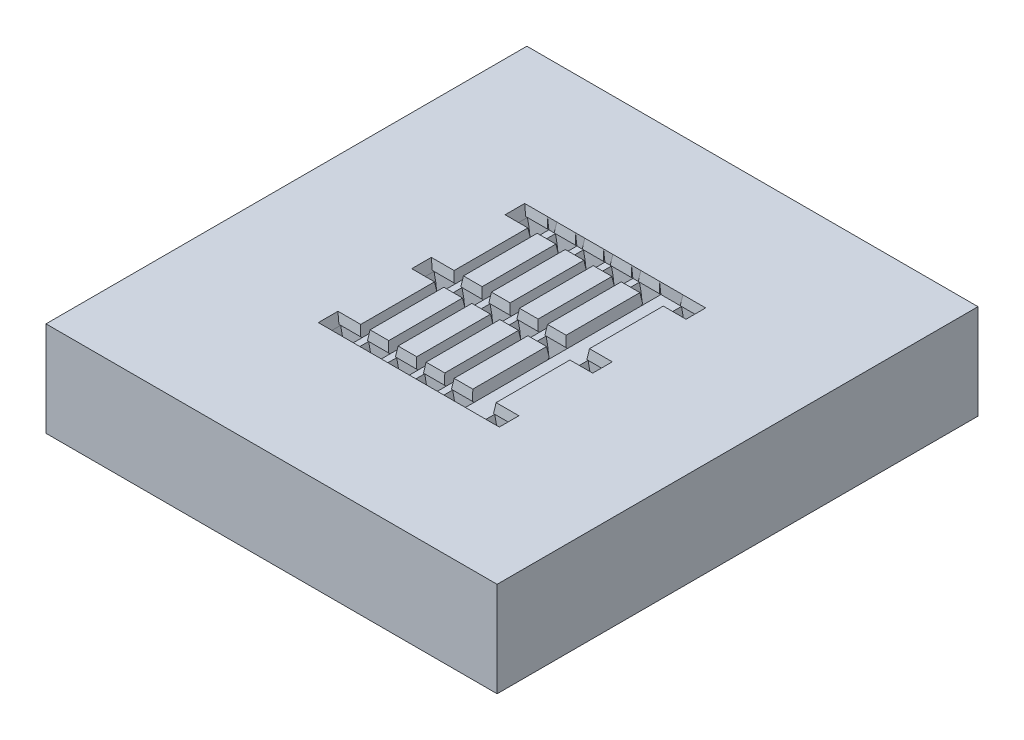
from build123d import *

# Parameters (mm, degrees)
BOSS_EXTRUDE2_START = -1.844035
SKETCH1_W           = 48.312388156
SKETCH1_H           = 51.5
BOSS_EXTRUDE2_DEPTH = 10.155965
CUT_EXTRUDE1_START  = -9.690354
CUT_EXTRUDE1_DEPTH  = 19.380708
CUT_EXTRUDE2_START  = 11.05
CUT_EXTRUDE2_DEPTH  = 22.1
BOSS_EXTRUDE3_START = -11.05
BOSS_EXTRUDE3_DEPTH = 22.1


with BuildPart() as part:
    # Sketch1 → Boss-Extrude2 (new body)
    with BuildSketch(Plane(origin=(0, 0, 0), x_dir=(1, 0, 0), z_dir=(0, 1, 0)).offset(BOSS_EXTRUDE2_START)):
        Rectangle(SKETCH1_W, SKETCH1_H)
    extrude(amount=-BOSS_EXTRUDE2_DEPTH)

    # Sketch7 → Cut-Extrude1 (cut)
    with BuildSketch(Plane(origin=(0, 0, 0), x_dir=(0, 0, -1), z_dir=(1, 0, 0)).offset(CUT_EXTRUDE1_START)):
        Polygon((10.9, -2.85), (11.05, -1.84403522), (8.95, -1.84403522), (9.1, -2.85), (8.95, -3), (8.95, -6.5), (11.05, -6.5), (11.05, -3), align=None)
        Polygon((-10.9, -2.85), (-11.05, -1.84403522), (-8.95, -1.84403522), (-9.1, -2.85), (-8.95, -3), (-8.95, -6.5), (-11.05, -6.5), (-11.05, -3), align=None)
        Polygon((-0.9, -2.85), (-1.05, -1.84403522), (1.05, -1.84403522), (0.9, -2.85), (1.05, -3), (1.05, -6.5), (-1.05, -6.5), (-1.05, -3), align=None)
    extrude(amount=CUT_EXTRUDE1_DEPTH, mode=Mode.SUBTRACT)

    # Sketch8 → Cut-Extrude2 (cut)
    with BuildSketch(Plane.XY.offset(CUT_EXTRUDE2_START)):
        Polygon((-7.25, -1.84403522), (-7.100480321, -3), (-6.399519679, -3), (-6.25, -1.84403522), align=None)
        Polygon((-4.25, -1.84403522), (-4.100480321, -3), (-3.399519679, -3), (-3.25, -1.84403522), align=None)
        Polygon((-1.25, -1.84403522), (-1.100480321, -3), (-0.399519679, -3), (-0.25, -1.84403522), align=None)
        Polygon((1.899519679, -3), (2.600480321, -3), (2.75, -1.84403522), (1.75, -1.84403522), align=None)
        Polygon((4.899519679, -3), (7.100480321, -3), (7.25, -1.84403522), (4.75, -1.84403522), align=None)
    extrude(amount=-CUT_EXTRUDE2_DEPTH, mode=Mode.SUBTRACT)

    # Sketch9 → Boss-Extrude3 (add)
    with BuildSketch(Plane.XY.offset(BOSS_EXTRUDE3_START)):
        with BuildLine():
            Line((-9.690353566, -1.84403522), (-9.690353566, -6.5))
            Line((-9.690353566, -6.5), (-9.115955217, -6.5))
            ThreePointArc((-9.115955217, -6.5), (-9.112473191, -4.73823092), (-9.399519679, -3))
            Line((-9.399519679, -3), (-9.690353566, -1.84403522))
        make_face()
        with BuildLine():
            Line((9.690353566, -1.84403522), (9.399519679, -3))
            ThreePointArc((9.399519679, -3), (9.112473191, -4.73823092), (9.115955217, -6.5))
            Line((9.115955217, -6.5), (9.690353566, -6.5))
            Line((9.690353566, -6.5), (9.690353566, -1.84403522))
        make_face()
        with BuildLine():
            Line((-7.100480321, -3), (-6.399519679, -3))
            ThreePointArc((-6.399519679, -3), (-6.112473191, -4.73823092), (-6.115955217, -6.5))
            Line((-6.115955217, -6.5), (-7.384044783, -6.5))
            ThreePointArc((-7.384044783, -6.5), (-7.387526809, -4.73823092), (-7.100480321, -3))
        make_face()
        with BuildLine():
            Line((-4.100480321, -3), (-3.399519679, -3))
            ThreePointArc((-3.399519679, -3), (-3.112473191, -4.73823092), (-3.115955217, -6.5))
            Line((-3.115955217, -6.5), (-4.384044783, -6.5))
            ThreePointArc((-4.384044783, -6.5), (-4.387526809, -4.73823092), (-4.100480321, -3))
        make_face()
        with BuildLine():
            Line((-1.100480321, -3), (-0.399519679, -3))
            ThreePointArc((-0.399519679, -3), (-0.112473191, -4.73823092), (-0.115955217, -6.5))
            Line((-0.115955217, -6.5), (-1.384044783, -6.5))
            ThreePointArc((-1.384044783, -6.5), (-1.387526809, -4.73823092), (-1.100480321, -3))
        make_face()
        with BuildLine():
            Line((1.899519679, -3), (2.600480321, -3))
            ThreePointArc((2.600480321, -3), (2.887526809, -4.73823092), (2.884044783, -6.5))
            Line((2.884044783, -6.5), (1.615955217, -6.5))
            ThreePointArc((1.615955217, -6.5), (1.612473191, -4.73823092), (1.899519679, -3))
        make_face()
        with BuildLine():
            Line((4.899519679, -3), (7.100480321, -3))
            ThreePointArc((7.100480321, -3), (7.387526809, -4.73823092), (7.384044783, -6.5))
            Line((7.384044783, -6.5), (4.615955217, -6.5))
            ThreePointArc((4.615955217, -6.5), (4.612473191, -4.73823092), (4.899519679, -3))
        make_face()
    extrude(amount=BOSS_EXTRUDE3_DEPTH)


solid = part.part
